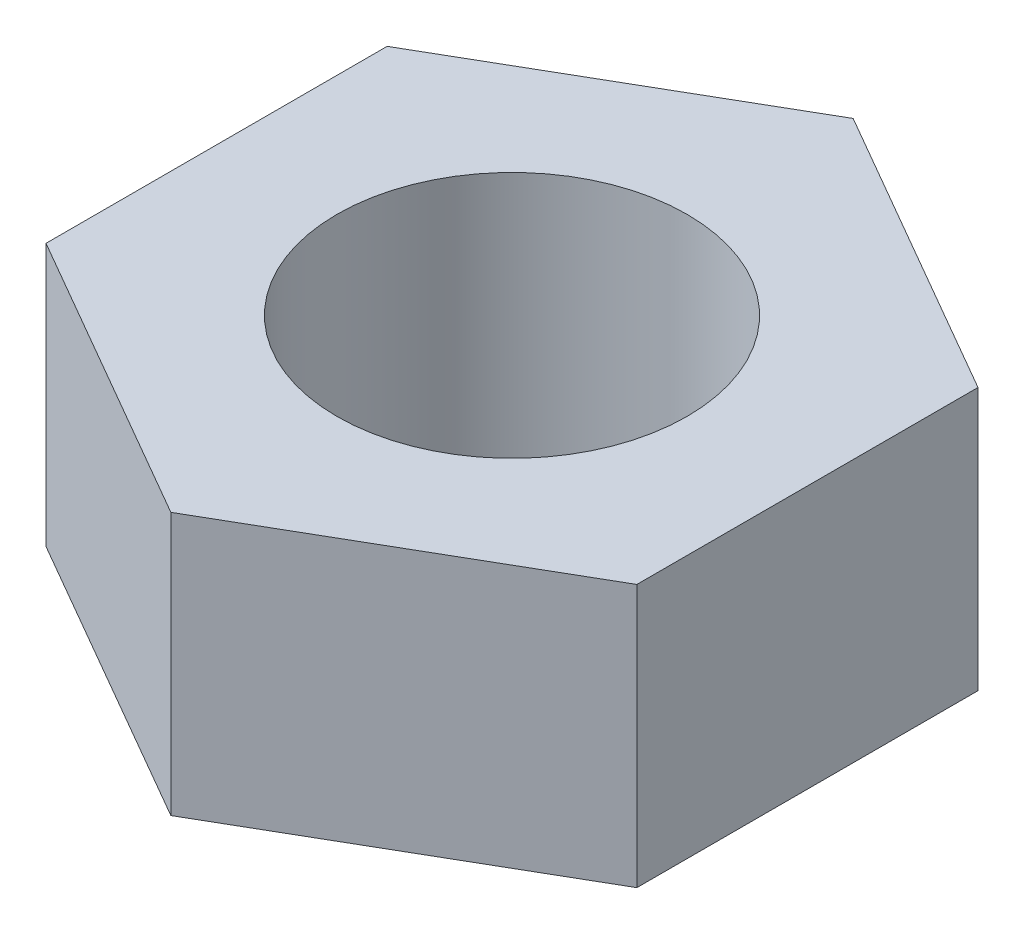
from build123d import *

# Parameters (mm, degrees)
SKETCH1_R           = 4
BOSS_EXTRUDE1_DEPTH = 6


with BuildPart() as part:
    # Sketch1 → Boss-Extrude1 (new body)
    with BuildSketch(Plane(origin=(0, 0, 0), x_dir=(1, 0, 0), z_dir=(0, 1, 0))):
        Polygon((0, 7.794228634), (-6.75, 3.897114317), (-6.75, -3.897114317), (0, -7.794228634), (6.75, -3.897114317), (6.75, 3.897114317), align=None)
        with Locations(Location((0, 0, 0), (0, 0, 270))):
            Circle(SKETCH1_R, mode=Mode.SUBTRACT)
    extrude(amount=BOSS_EXTRUDE1_DEPTH)


solid = part.part
